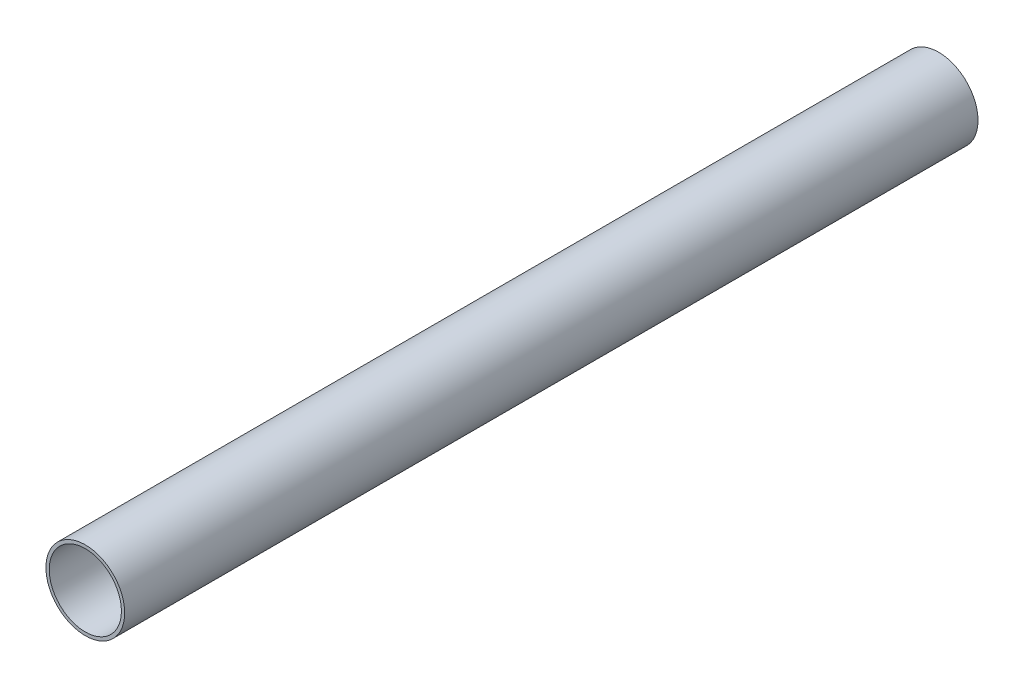
from build123d import *

# Parameters (mm, degrees)
IZIM1_R                     = 12
IZIM1_R_2                   = 11
Y_KSEKLIK_EKSTR_ZYON1_DEPTH = 260


with BuildPart() as part:
    # Çizim1 → Yükseklik-Ekstrüzyon1 (new body)
    with BuildSketch(Plane.XY):
        Circle(IZIM1_R)
        Circle(IZIM1_R_2, mode=Mode.SUBTRACT)
    extrude(amount=Y_KSEKLIK_EKSTR_ZYON1_DEPTH)


solid = part.part
